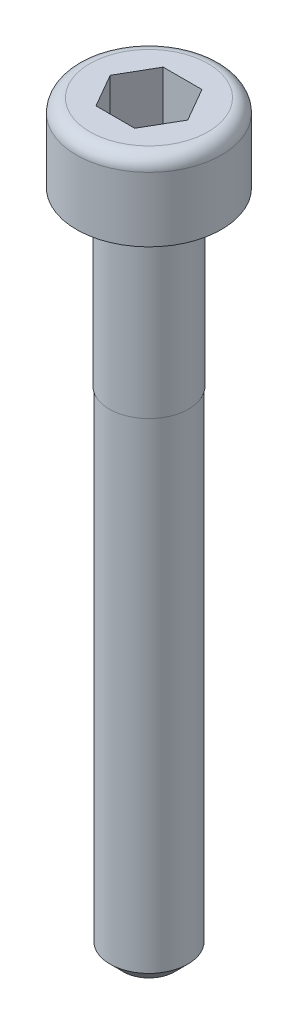
from build123d import *

# Parameters (mm, degrees)
ENL_V_MAT_EXTRU_1_DEPTH = 2


with BuildPart() as part:
    # Esquisse1 → Révolution1 (revolve)
    with BuildSketch(Plane.XY):
        with BuildLine():
            Line((0, 2.9), (-2.2, 2.9))
            ThreePointArc((-2.2, 2.9), (-2.553553391, 2.753553391), (-2.7, 2.4))
            Line((-2.7, 2.4), (-2.7, 0))
            Line((-2.7, 0), (-1.475, 0))
            Line((-1.475, 0), (-1.475, -6.4))
            Line((-1.475, -6.4), (-1.45, -6.4))
            Line((-1.45, -6.4), (-1.45, -24.3))
            Line((-1.45, -24.3), (-0.95, -24.8))
            Line((-0.95, -24.8), (0, -24.8))
            Line((0, -24.8), (0, 2.9))
        make_face()
    revolve(axis=Axis((0, 15.825722622, 0), (0, -1, 0)))

    # Esquisse2 → Enlèv. mat.-Extru.1 (cut)
    with BuildSketch(Plane(origin=(0, 2.9, 0), x_dir=(-1, 0, 0), z_dir=(0, 1, 0))):
        Polygon((-1.443375673, 0), (-0.721687836, -1.25), (0.721687836, -1.25), (1.443375673, 0), (0.721687836, 1.25), (-0.721687836, 1.25), align=None)
    extrude(amount=-ENL_V_MAT_EXTRU_1_DEPTH, mode=Mode.SUBTRACT)


solid = part.part
